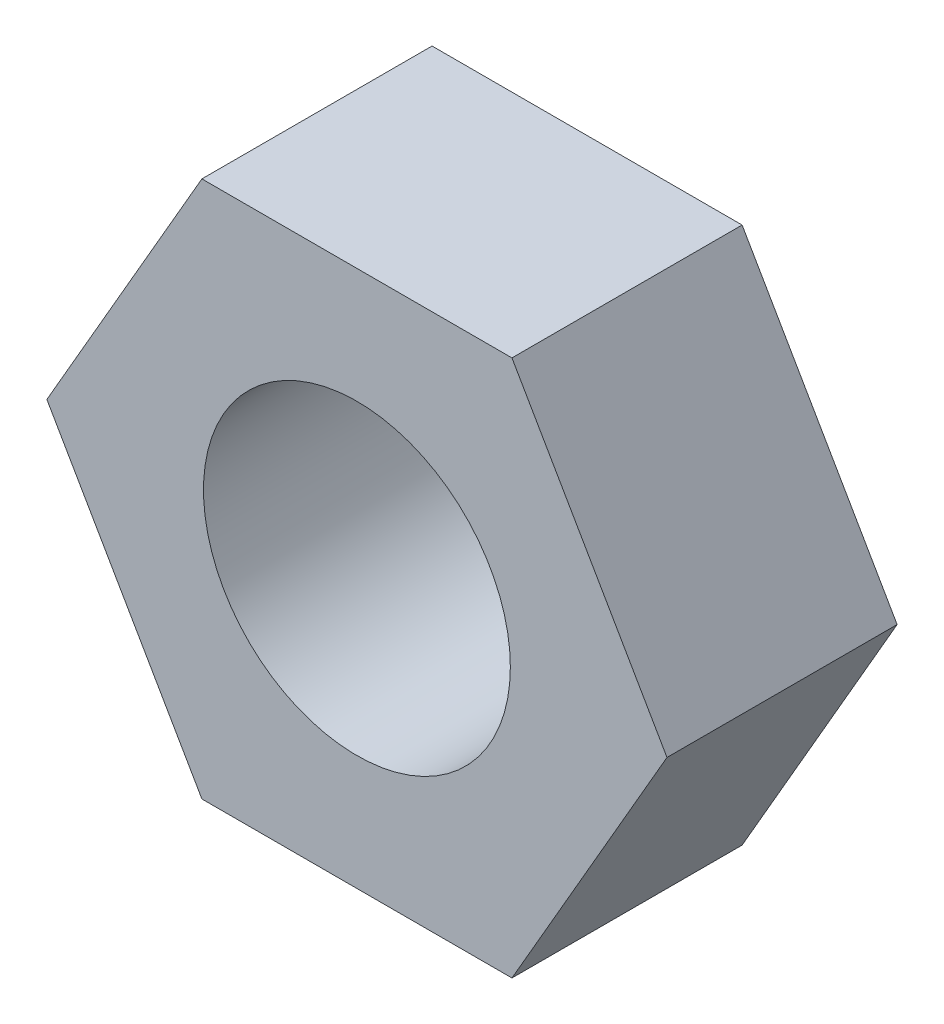
from build123d import *

# Parameters (mm, degrees)
SKETCH1_R           = 2
BOSS_EXTRUDE1_DEPTH = 3


with BuildPart() as part:
    # Sketch1 → Boss-Extrude1 (new body)
    with BuildSketch(Plane.XY):
        Polygon((-4.041451884, 0), (-2.020725942, -3.5), (2.020725942, -3.5), (4.041451884, 0), (2.020725942, 3.5), (-2.020725942, 3.5), align=None)
        Circle(SKETCH1_R, mode=Mode.SUBTRACT)
    extrude(amount=BOSS_EXTRUDE1_DEPTH)


solid = part.part
